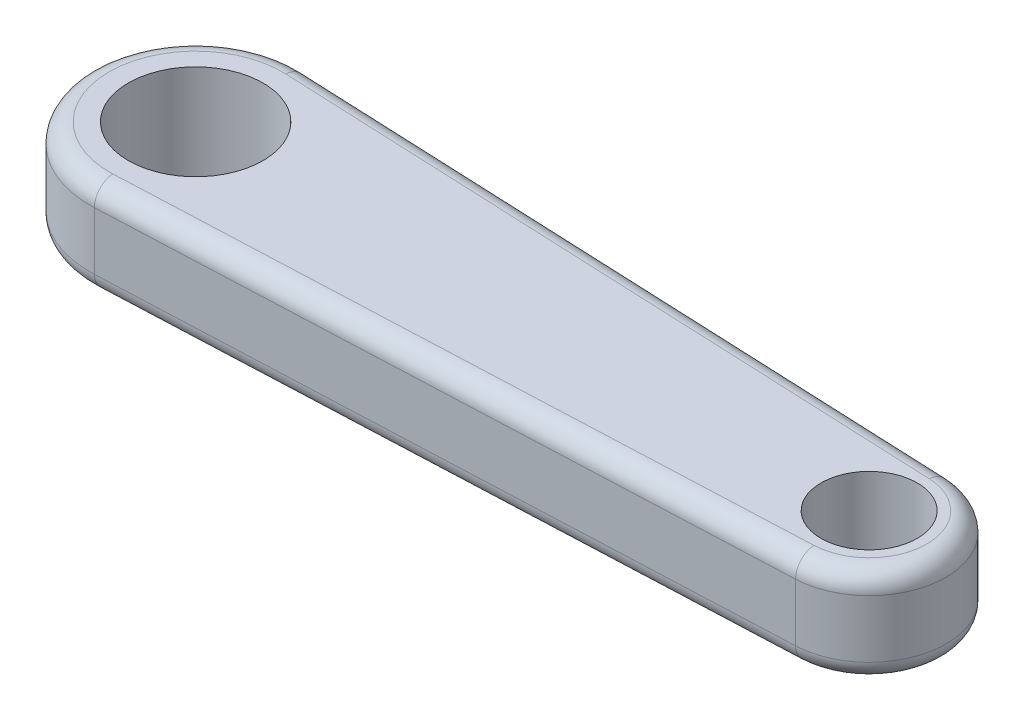
from build123d import *

# Parameters (mm, degrees)
CROQUIS1_R              = 35
CROQUIS1_R_2            = 25
SALIENTE_EXTRUIR1_DEPTH = 50
REDONDEO1_R             = 10


with BuildPart() as part:
    # Croquis1 → Saliente-Extruir1 (new body)
    with BuildSketch(Plane(origin=(0, 0, 0), x_dir=(1, 0, 0), z_dir=(0, 1, 0))):
        with BuildLine():
            Line((-147.642857143, 54.949466581), (201.714285714, 39.963248423))
            ThreePointArc((201.714285714, 39.963248423), (240, 0), (201.714285714, -39.963248423))
            Line((201.714285714, -39.963248423), (-147.642857143, -54.949466581))
            ThreePointArc((-147.642857143, -54.949466581), (-205, 0), (-147.642857143, 54.949466581))
        make_face()
        with Locations(Location((-150, 0, 0), (0, 0, 270))):
            Circle(CROQUIS1_R, mode=Mode.SUBTRACT)
        with Locations(Location((200, 0, 0), (0, 0, 270))):
            Circle(CROQUIS1_R_2, mode=Mode.SUBTRACT)
    extrude(amount=SALIENTE_EXTRUIR1_DEPTH)

    # Redondeo1
    redondeo1_edges = [part.edges().sort_by_distance(p)[0] for p in [
        (240, 50, 0),
        (27.035714286, 50, -47.456357502),
        (-205, 50, 0),
        (27.035714286, 0, -47.456357502),
        (240, 0, 0),
        (27.035714286, 0, 47.456357502),
        (-205, 0, 0),
        (27.035714286, 50, 47.456357502),
    ]]
    fillet(redondeo1_edges, radius=REDONDEO1_R)


solid = part.part
